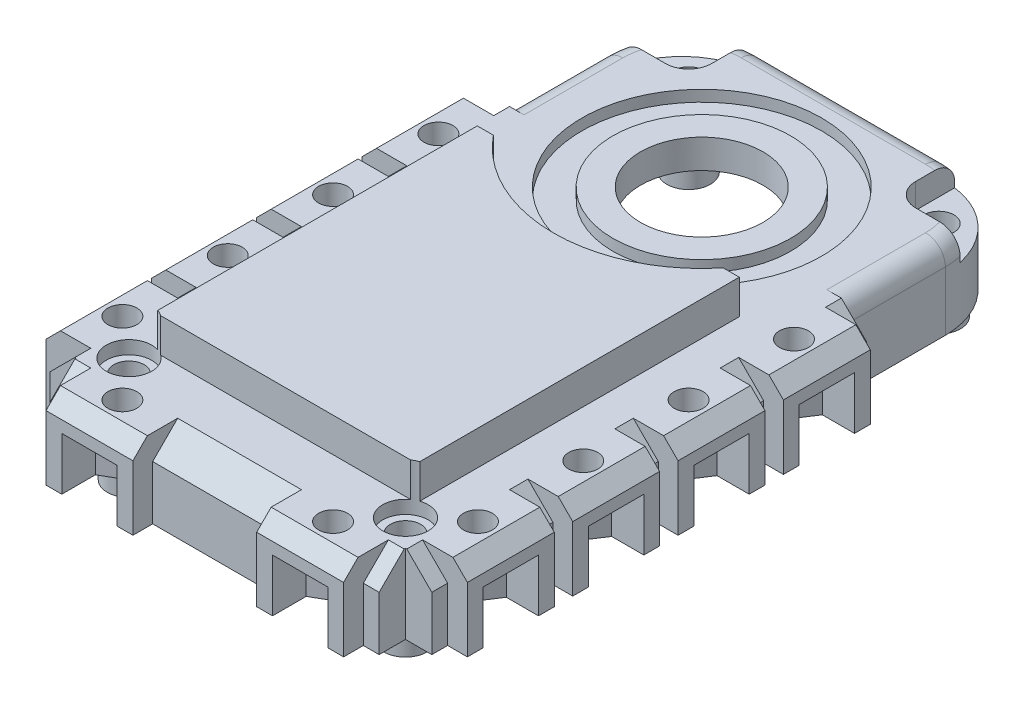
from build123d import *

# Parameters (mm, degrees)
SKETCH1_W            = 32
SKETCH1_H            = 50
BOSS_EXTRUDE1_DEPTH  = 3
CUT_EXTRUDE1_DEPTH   = 10
SKETCH5_R            = 1.1
CUT_EXTRUDE2_DEPTH   = 10
CHAMFER1_SIZE        = 1.1
FILLET1_R            = 1.5
CHAMFER2_SIZE        = 1.9
SKETCH24_R           = 9.1
CUT_EXTRUDE15_DEPTH  = 0.85
SKETCH8_R            = 6.75
BOSS_EXTRUDE3_DEPTH  = 0.85
CUT_EXTRUDE7_DEPTH   = 1.5
CUT_EXTRUDE8_REACH   = 32.282
LPATTERN1_COUNT      = 4
LPATTERN1_PITCH      = 8
CUT_EXTRUDE9_DEPTH   = 1.55
CUT_EXTRUDE10_REACH  = 32.282
MIRROR2_COPY_1_DEPTH = 1.5
MIRROR2_COPY_2_DEPTH = 1.5
MIRROR2_COPY_3_DEPTH = 1.5
MIRROR2_COPY_4_REACH = 32.282
MIRROR2_COPY_5_REACH = 32.282
MIRROR2_COPY_6_REACH = 32.282
CUT_EXTRUDE11_DEPTH  = 3.8
SKETCH22_R           = 1.65
BOSS_EXTRUDE7_DEPTH  = 5.8
SKETCH23_R           = 1.15
CUT_EXTRUDE13_DEPTH  = 31.740852379
SKETCH17_R           = 4.65
CUT_EXTRUDE14_DEPTH  = 10
BOSS_EXTRUDE8_DEPTH  = 2.6
CUT_EXTRUDE16_DEPTH  = 1.9
SKETCH27_R           = 1.725
CUT_EXTRUDE17_DEPTH  = 3.6


with BuildPart() as part:
    # Sketch1 → Boss-Extrude1 (new, symmetric)
    with BuildSketch(Plane(origin=(0, 0, 0), x_dir=(1, 0, 0), z_dir=(0, 1, 0))):
        Rectangle(SKETCH1_W, SKETCH1_H)
    extrude(amount=BOSS_EXTRUDE1_DEPTH, both=True)

    # Sketch4 → Cut-Extrude1 (cut)
    with BuildSketch(Plane(origin=(0, 3, 0), x_dir=(1, 0, 0), z_dir=(0, 1, 0))):
        with BuildLine():
            Line((-13, 19), (-13, 11.5))
            Line((-13, 11.5), (-14.5, 11.5))
            Line((-14.5, 11.5), (-14.5, 10.3))
            Line((-14.5, 10.3), (-16, 10.3))
            Line((-16, 10.3), (-16, 3.7))
            Line((-16, 3.7), (-14.5, 3.7))
            Line((-14.5, 3.7), (-14.5, 2.3))
            Line((-14.5, 2.3), (-16, 2.3))
            Line((-16, 2.3), (-16, -4.3))
            Line((-16, -4.3), (-14.5, -4.3))
            Line((-14.5, -4.3), (-14.5, -5.7))
            Line((-14.5, -5.7), (-16, -5.7))
            Line((-16, -5.7), (-16, -12.3))
            Line((-16, -12.3), (-14.5, -12.3))
            Line((-14.5, -12.3), (-14.5, -13.7))
            Line((-14.5, -13.7), (-16, -13.7))
            Line((-16, -13.7), (-16, -20.3))
            Line((-16, -20.3), (-14.5, -20.3))
            Line((-14.5, -20.3), (-14.5, -21.5))
            Line((-14.5, -21.5), (-12.5, -21.5))
            Line((-12.5, -21.5), (-12.5, -23.5))
            Line((-12.5, -23.5), (-11.3, -23.5))
            Line((-11.3, -23.5), (-11.3, -25))
            Line((-11.3, -25), (-4.7, -25))
            Line((-4.7, -25), (-4.7, -23.5))
            Line((-4.7, -23.5), (0, -23.5))
            Line((0, -23.5), (0, -26))
            Line((0, -26), (-20, -26))
            Line((-20, -26), (-20, 25))
            Line((-20, 25), (-7, 25))
            ThreePointArc((-7, 25), (-11.242640687, 23.242640687), (-13, 19))
        make_face()
    cut_extrude1 = extrude(amount=-CUT_EXTRUDE1_DEPTH, mode=Mode.SUBTRACT)

    # Mirror1: Cut-Extrude1 across plane
    add(cut_extrude1.mirror(Plane(origin=(0, 0, 0), x_dir=(0, 0, 1), z_dir=(1, 0, 0))), mode=Mode.SUBTRACT)

    # Sketch5 → Cut-Extrude2 (cut)
    with BuildSketch(Plane(origin=(0, 3, 0), x_dir=(1, 0, 0), z_dir=(0, 1, 0))):
        with Locations(Location((-13.5, 7, 0), (0, 0, 270))):
            Circle(SKETCH5_R)
        with Locations(Location((13.5, 7, 0), (0, 0, 270))):
            Circle(SKETCH5_R)
        with Locations(Location((13.5, -1, 0), (0, 0, 270))):
            Circle(SKETCH5_R)
        with Locations(Location((13.5, -9, 0), (0, 0, 270))):
            Circle(SKETCH5_R)
        with Locations(Location((13.5, -17, 0), (0, 0, 270))):
            Circle(SKETCH5_R)
        with Locations(Location((-13.5, -1, 0), (0, 0, 270))):
            Circle(SKETCH5_R)
        with Locations(Location((-13.5, -9, 0), (0, 0, 270))):
            Circle(SKETCH5_R)
        with Locations(Location((-13.5, -17, 0), (0, 0, 270))):
            Circle(SKETCH5_R)
        with Locations(Location((-8, -22.5, 0), (0, 0, 270))):
            Circle(SKETCH5_R)
        with Locations(Location((8, -22.5, 0), (0, 0, 270))):
            Circle(SKETCH5_R)
    extrude(amount=-CUT_EXTRUDE2_DEPTH, mode=Mode.SUBTRACT)

    # Chamfer1
    chamfer1_edges = [part.edges().sort_by_distance(p)[0] for p in [
        (8, 3, 25),
        (16, 3, 17),
        (16, 3, 9),
        (16, 3, 1),
        (16, 3, -7),
        (-16, 3, -7),
        (-16, 3, 1),
        (-16, 3, 9),
        (-16, 3, 17),
        (-8, 3, 25),
    ]]
    chamfer(chamfer1_edges, length=CHAMFER1_SIZE)

    # Fillet1
    fillet1_edges = [part.edges().sort_by_distance(p)[0] for p in [
        (0, 3, -25),
        (13, 3, -15.25),
        (11.242640687, 3, -23.242640687),
        (-13, 3, -15.25),
        (-11.242640687, 3, -23.242640687),
    ]]
    fillet(fillet1_edges, radius=FILLET1_R)

    # Chamfer2
    chamfer2_edges = [part.edges().sort_by_distance(p)[0] for p in [
        (11.9, 3, 23.5),
        (14.5, 3, 20.9),
        (14.5, 3, 13),
        (14.5, 3, 5),
        (14.5, 3, -3),
        (14.5, 3, -10.9),
        (-14.5, 3, -10.9),
        (-14.5, 3, -3),
        (-14.5, 3, 5),
        (-14.5, 3, 13),
        (-11.9, 3, 23.5),
        (-14.5, 3, 20.9),
        (0, 3, 23.5),
    ]]
    chamfer(chamfer2_edges, length=CHAMFER2_SIZE)

    # Sketch24 → Cut-Extrude15 (cut)
    with BuildSketch(Plane(origin=(0, 3, 0), x_dir=(1, 0, 0), z_dir=(0, 1, 0))):
        with Locations(Location((0, 13.5, 0), (0, 0, 270))):
            Circle(SKETCH24_R)
    extrude(amount=-CUT_EXTRUDE15_DEPTH, mode=Mode.SUBTRACT)

    # Sketch8 → Boss-Extrude3 (add)
    with BuildSketch(Plane(origin=(0, 3, 0), x_dir=(1, 0, 0), z_dir=(0, 1, 0))):
        with Locations(Location((0, 13.5, 0), (0, 0, 270))):
            Circle(SKETCH8_R)
    extrude(amount=-BOSS_EXTRUDE3_DEPTH)

    # Sketch12 → Cut-Extrude7 (cut)
    with BuildSketch(Plane(origin=(0, 1, 0), x_dir=(1, 0, 0), z_dir=(0, 1, 0))):
        Polygon((-12.287564435, 9.1), (-14.712435565, 9.1), (-17.712435565, 9.1), (-17.712435565, 4.9), (-14.712435565, 4.9), (-12.287564435, 4.9), (-11.075128869, 7), align=None)
    cut_extrude7 = extrude(amount=-CUT_EXTRUDE7_DEPTH, mode=Mode.SUBTRACT)

    # Sketch13 → Cut-Extrude8 (cut, up to next)
    with BuildSketch(Plane.XZ.offset(3), mode=Mode.PRIVATE) as cut_extrude8_sk1:
        with BuildLine():
            Line((-16, -4.9), (-13.442264973, -4.9))
            Line((-13.442264973, -4.9), (-12.547372056, -6.45))
            ThreePointArc((-12.547372056, -6.45), (-12.400415486, -7.030230734), (-12.579030386, -7.601510574))
            Line((-12.579030386, -7.601510574), (-13.557735027, -9.1))
            Line((-13.557735027, -9.1), (-16, -9.1))
            Line((-16, -9.1), (-16, -4.9))
        make_face()
    cut_extrude8_tool1 = extrude(cut_extrude8_sk1.sketch, amount=-CUT_EXTRUDE8_REACH, mode=Mode.PRIVATE) & part.part
    cut_extrude8 = cut_extrude8_tool1.solids().sort_by_distance((-14.416857, -3, -6.989337))[0]
    add(cut_extrude8, mode=Mode.SUBTRACT)

    # LPattern1: Cut-Extrude7, Cut-Extrude8 ×4
    with Locations(*[(0, 0, i * LPATTERN1_PITCH) for i in range(1, LPATTERN1_COUNT)]):
        add(cut_extrude7, mode=Mode.SUBTRACT)
        add(cut_extrude8, mode=Mode.SUBTRACT)

    # Sketch14 → Cut-Extrude9 (cut)
    with BuildSketch(Plane(origin=(0, 1, 0), x_dir=(1, 0, 0), z_dir=(0, 1, 0))):
        Polygon((-5.9, -23.712435565), (-5.9, -21.287564435), (-8, -20.075128869), (-10.1, -21.287564435), (-10.1, -23.712435565), (-10.1, -26.712435565), (-5.9, -26.712435565), align=None)
    cut_extrude9 = extrude(amount=-CUT_EXTRUDE9_DEPTH, mode=Mode.SUBTRACT)

    # Sketch15 → Cut-Extrude10 (cut, up to next)
    with BuildSketch(Plane.XZ.offset(3), mode=Mode.PRIVATE) as cut_extrude10_sk1:
        with BuildLine():
            Line((-10.1, 25), (-5.9, 25))
            Line((-5.9, 25), (-5.9, 22.442264973))
            Line((-5.9, 22.442264973), (-7.45, 21.547372056))
            ThreePointArc((-7.45, 21.547372056), (-8, 21.4), (-8.55, 21.547372056))
            Line((-8.55, 21.547372056), (-10.1, 22.442264973))
            Line((-10.1, 22.442264973), (-10.1, 25))
        make_face()
    cut_extrude10_tool1 = extrude(cut_extrude10_sk1.sketch, amount=-CUT_EXTRUDE10_REACH, mode=Mode.PRIVATE) & part.part
    cut_extrude10 = cut_extrude10_tool1.solids().sort_by_distance((-8, -3, 23.408677))[0]
    add(cut_extrude10, mode=Mode.SUBTRACT)

    # Mirror2: Cut-Extrude7, Cut-Extrude8, Cut-Extrude9, Cut-Extrude10 across plane
    add(cut_extrude7.mirror(Plane(origin=(0, 0, 0), x_dir=(0, 0, 1), z_dir=(1, 0, 0))), mode=Mode.SUBTRACT)
    add(cut_extrude8.mirror(Plane(origin=(0, 0, 0), x_dir=(0, 0, 1), z_dir=(1, 0, 0))), mode=Mode.SUBTRACT)
    add(cut_extrude9.mirror(Plane(origin=(0, 0, 0), x_dir=(0, 0, 1), z_dir=(1, 0, 0))), mode=Mode.SUBTRACT)
    add(cut_extrude10.mirror(Plane(origin=(0, 0, 0), x_dir=(0, 0, 1), z_dir=(1, 0, 0))), mode=Mode.SUBTRACT)

    # Mirror2 copy 1 sketch → Mirror2 copy 1 (cut)
    with BuildSketch(Plane(origin=(0, 1, 8), x_dir=(-1, 0, 0), z_dir=(0, 1, 0))):
        Polygon((-12.287564435, -9.1), (-14.712435565, -9.1), (-17.712435565, -9.1), (-17.712435565, -4.9), (-14.712435565, -4.9), (-12.287564435, -4.9), (-11.075128869, -7), align=None)
    extrude(amount=-MIRROR2_COPY_1_DEPTH, mode=Mode.SUBTRACT)

    # Mirror2 copy 2 sketch → Mirror2 copy 2 (cut)
    with BuildSketch(Plane(origin=(0, 1, 16), x_dir=(-1, 0, 0), z_dir=(0, 1, 0))):
        Polygon((-12.287564435, -9.1), (-14.712435565, -9.1), (-17.712435565, -9.1), (-17.712435565, -4.9), (-14.712435565, -4.9), (-12.287564435, -4.9), (-11.075128869, -7), align=None)
    extrude(amount=-MIRROR2_COPY_2_DEPTH, mode=Mode.SUBTRACT)

    # Mirror2 copy 3 sketch → Mirror2 copy 3 (cut)
    with BuildSketch(Plane(origin=(0, 1, 24), x_dir=(-1, 0, 0), z_dir=(0, 1, 0))):
        Polygon((-12.287564435, -9.1), (-14.712435565, -9.1), (-17.712435565, -9.1), (-17.712435565, -4.9), (-14.712435565, -4.9), (-12.287564435, -4.9), (-11.075128869, -7), align=None)
    extrude(amount=-MIRROR2_COPY_3_DEPTH, mode=Mode.SUBTRACT)

    # Mirror2 copy 4 sketch → Mirror2 copy 4 (cut, up to next)
    with BuildSketch(Plane(origin=(0, -3, 8), x_dir=(-1, 0, 0), z_dir=(0, -1, 0)), mode=Mode.PRIVATE) as mirror2_copy_4_sk1:
        with BuildLine():
            Line((-16, 4.9), (-13.442264973, 4.9))
            Line((-13.442264973, 4.9), (-12.547372056, 6.45))
            ThreePointArc((-12.547372056, 6.45), (-12.400415486, 7.030230734), (-12.579030386, 7.601510574))
            Line((-12.579030386, 7.601510574), (-13.557735027, 9.1))
            Line((-13.557735027, 9.1), (-16, 9.1))
            Line((-16, 9.1), (-16, 4.9))
        make_face()
    mirror2_copy_4_tool1 = extrude(mirror2_copy_4_sk1.sketch, amount=-MIRROR2_COPY_4_REACH, mode=Mode.PRIVATE) & part.part
    add(mirror2_copy_4_tool1.solids().sort_by_distance((14.416857, -3, 1.010663))[0], mode=Mode.SUBTRACT)

    # Mirror2 copy 5 sketch → Mirror2 copy 5 (cut, up to next)
    with BuildSketch(Plane(origin=(0, -3, 16), x_dir=(-1, 0, 0), z_dir=(0, -1, 0)), mode=Mode.PRIVATE) as mirror2_copy_5_sk1:
        with BuildLine():
            Line((-16, 4.9), (-13.442264973, 4.9))
            Line((-13.442264973, 4.9), (-12.547372056, 6.45))
            ThreePointArc((-12.547372056, 6.45), (-12.400415486, 7.030230734), (-12.579030386, 7.601510574))
            Line((-12.579030386, 7.601510574), (-13.557735027, 9.1))
            Line((-13.557735027, 9.1), (-16, 9.1))
            Line((-16, 9.1), (-16, 4.9))
        make_face()
    mirror2_copy_5_tool1 = extrude(mirror2_copy_5_sk1.sketch, amount=-MIRROR2_COPY_5_REACH, mode=Mode.PRIVATE) & part.part
    add(mirror2_copy_5_tool1.solids().sort_by_distance((14.416857, -3, 9.010663))[0], mode=Mode.SUBTRACT)

    # Mirror2 copy 6 sketch → Mirror2 copy 6 (cut, up to next)
    with BuildSketch(Plane(origin=(0, -3, 24), x_dir=(-1, 0, 0), z_dir=(0, -1, 0)), mode=Mode.PRIVATE) as mirror2_copy_6_sk1:
        with BuildLine():
            Line((-16, 4.9), (-13.442264973, 4.9))
            Line((-13.442264973, 4.9), (-12.547372056, 6.45))
            ThreePointArc((-12.547372056, 6.45), (-12.400415486, 7.030230734), (-12.579030386, 7.601510574))
            Line((-12.579030386, 7.601510574), (-13.557735027, 9.1))
            Line((-13.557735027, 9.1), (-16, 9.1))
            Line((-16, 9.1), (-16, 4.9))
        make_face()
    mirror2_copy_6_tool1 = extrude(mirror2_copy_6_sk1.sketch, amount=-MIRROR2_COPY_6_REACH, mode=Mode.PRIVATE) & part.part
    add(mirror2_copy_6_tool1.solids().sort_by_distance((14.416857, -3, 17.010663))[0], mode=Mode.SUBTRACT)

    # Sketch16 → Cut-Extrude11 (cut)
    with BuildSketch(Plane.XZ.offset(3)):
        with BuildLine():
            Line((-11.74, 19.1), (11.74, 19.1))
            Line((11.74, 19.1), (11.74, -17.74))
            ThreePointArc((11.74, -17.74), (9.982640687, -21.982640687), (5.74, -23.74))
            Line((5.74, -23.74), (-5.74, -23.74))
            ThreePointArc((-5.74, -23.74), (-9.982640687, -21.982640687), (-11.74, -17.74))
            Line((-11.74, -17.74), (-11.74, 19.1))
        make_face()
    extrude(amount=-CUT_EXTRUDE11_DEPTH, mode=Mode.SUBTRACT)

    # Sketch22 → Boss-Extrude7 (add)
    with BuildSketch(Plane.XZ.offset(-0.8)):
        with Locations(Location((-10.5, 19.5, 0), (0, 0, 345.970334599))):
            Circle(SKETCH22_R)
        with Locations(Location((10.5, 19.5, 0), (0, 0, 194.029665401))):
            Circle(SKETCH22_R)
        with Locations(Location((9.5, -22, 0), (0, 0, 38.398999159))):
            Circle(SKETCH22_R)
        with Locations(Location((-9.5, -22, 0), (0, 0, 141.601000841))):
            Circle(SKETCH22_R)
    extrude(amount=BOSS_EXTRUDE7_DEPTH)

    # Sketch23 → Cut-Extrude13 (cut, through all)
    with BuildSketch(Plane.XZ.offset(5)):
        with Locations(Location((10.5, 19.5, 0), (0, 0, 270))):
            Circle(SKETCH23_R)
        with Locations(Location((-10.5, 19.5, 0), (0, 0, 270))):
            Circle(SKETCH23_R)
        with Locations(Location((9.5, -22, 0), (0, 0, 270))):
            Circle(SKETCH23_R)
        with Locations(Location((-9.5, -22, 0), (0, 0, 270))):
            Circle(SKETCH23_R)
    extrude(amount=-CUT_EXTRUDE13_DEPTH, mode=Mode.SUBTRACT)

    # Sketch17 → Cut-Extrude14 (cut)
    with BuildSketch(Plane.XZ.offset(-0.8)):
        with Locations(Location((0, -13.5, 0), (0, 0, 270))):
            Circle(SKETCH17_R)
    extrude(amount=-CUT_EXTRUDE14_DEPTH, mode=Mode.SUBTRACT)

    # Sketch25 → Boss-Extrude8 (add)
    with BuildSketch(Plane(origin=(0, 3, 0), x_dir=(1, 0, 0), z_dir=(0, 1, 0))):
        with BuildLine():
            Line((-9.95, 6.4), (-8.726539979, 6.4))
            ThreePointArc((-8.726539979, 6.4), (0, 2.25), (8.726539979, 6.4))
            Line((8.726539979, 6.4), (9.95, 6.4))
            Line((9.95, 6.4), (9.95, -18.1))
            Line((9.95, -18.1), (-9.95, -18.1))
            Line((-9.95, -18.1), (-9.95, 6.4))
        make_face()
    extrude(amount=BOSS_EXTRUDE8_DEPTH)

    # Sketch26 → Cut-Extrude16 (cut)
    with BuildSketch(Plane(origin=(0, 3, 0), x_dir=(1, 0, 0), z_dir=(0, 1, 0))):
        with BuildLine():
            Line((-7.75, 24.95294045), (-7.75, 22))
            ThreePointArc((-7.75, 22), (-8.262563133, 20.762563133), (-9.5, 20.25))
            Line((-9.5, 20.25), (-12.868347297, 20.25))
            ThreePointArc((-12.868347297, 20.25), (-11.059561855, 23.418139602), (-7.75, 24.95294045))
        make_face()
    cut_extrude16 = extrude(amount=-CUT_EXTRUDE16_DEPTH, mode=Mode.SUBTRACT)

    # Sketch27 → Cut-Extrude17 (cut)
    with BuildSketch(Plane(origin=(0, 5.6, 0), x_dir=(1, 0, 0), z_dir=(0, 1, 0))):
        with Locations(Location((-10.5, -19.5, 0), (0, 0, 54.25198306))):
            Circle(SKETCH27_R)
    cut_extrude17 = extrude(amount=-CUT_EXTRUDE17_DEPTH, mode=Mode.SUBTRACT)

    # Mirror3: Cut-Extrude16, Cut-Extrude17 across plane
    add(cut_extrude16.mirror(Plane(origin=(0, 0, 0), x_dir=(0, 0, 1), z_dir=(1, 0, 0))), mode=Mode.SUBTRACT)
    add(cut_extrude17.mirror(Plane(origin=(0, 0, 0), x_dir=(0, 0, 1), z_dir=(1, 0, 0))), mode=Mode.SUBTRACT)


solid = part.part
